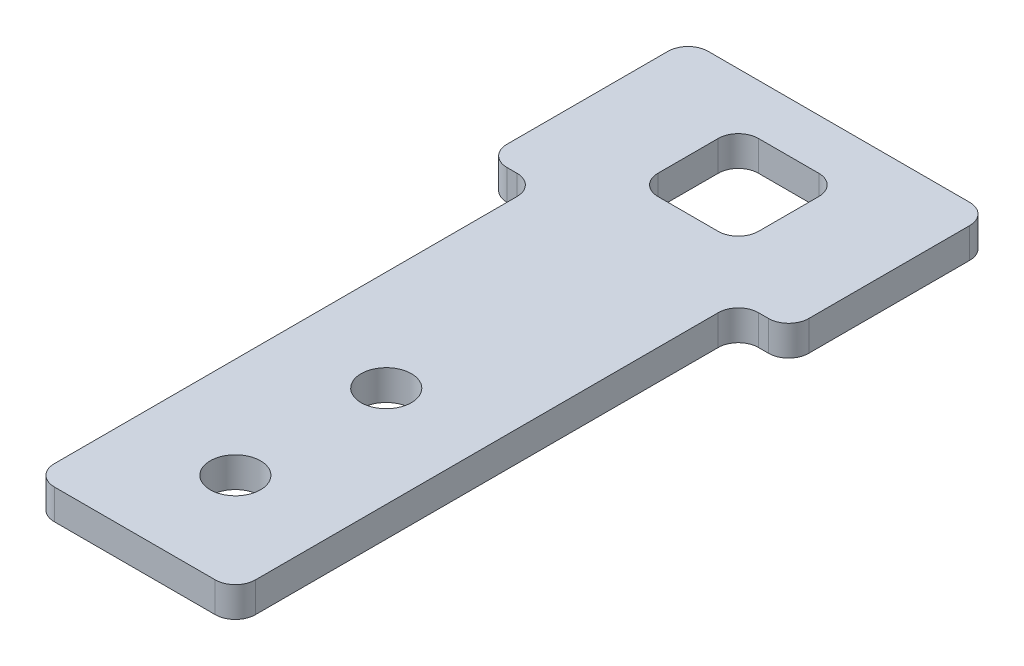
from build123d import *

# Parameters (mm, degrees)
SKETCH_1_R      = 2.5
EXTRUDE_1_DEPTH = 3


with BuildPart() as part:
    # 草图1 → 凸台-拉伸1 (new body)
    with BuildSketch(Plane(origin=(0, 0, 0), x_dir=(1, 0, 0), z_dir=(0, 1, 0))):
        with BuildLine():
            Line((22, 50), (23, 50))
            ThreePointArc((23, 50), (24.414213562, 50.585786438), (25, 52))
            Line((25, 52), (25, 68))
            ThreePointArc((25, 68), (24.414213562, 69.414213562), (23, 70))
            Line((23, 70), (-3, 70))
            ThreePointArc((-3, 70), (-4.414213562, 69.414213562), (-5, 68))
            Line((-5, 68), (-5, 52))
            ThreePointArc((-5, 52), (-4.414213562, 50.585786438), (-3, 50))
            Line((-3, 50), (-2, 50))
            ThreePointArc((-2, 50), (-0.585786438, 49.414213562), (0, 48))
            Line((0, 48), (0, 2))
            ThreePointArc((0, 2), (0.585786438, 0.585786438), (2, 0))
            Line((2, 0), (18, 0))
            ThreePointArc((18, 0), (19.414213562, 0.585786438), (20, 2))
            Line((20, 2), (20, 48))
            ThreePointArc((20, 48), (20.585786438, 49.414213562), (22, 50))
        make_face()
        with Locations(Location((10, 25, 0), (0, 0, 270))):
            Circle(SKETCH_1_R, mode=Mode.SUBTRACT)
        with Locations(Location((10, 10, 0), (0, 0, 270))):
            Circle(SKETCH_1_R, mode=Mode.SUBTRACT)
        with BuildLine():
            Line((7, 65), (13, 65))
            ThreePointArc((13, 65), (14.414213562, 64.414213562), (15, 63))
            Line((15, 63), (15, 57))
            ThreePointArc((15, 57), (14.414213562, 55.585786438), (13, 55))
            Line((13, 55), (7, 55))
            ThreePointArc((7, 55), (5.585786438, 55.585786438), (5, 57))
            Line((5, 57), (5, 63))
            ThreePointArc((5, 63), (5.585786438, 64.414213562), (7, 65))
        make_face(mode=Mode.SUBTRACT)
    extrude(amount=-EXTRUDE_1_DEPTH)


solid = part.part
